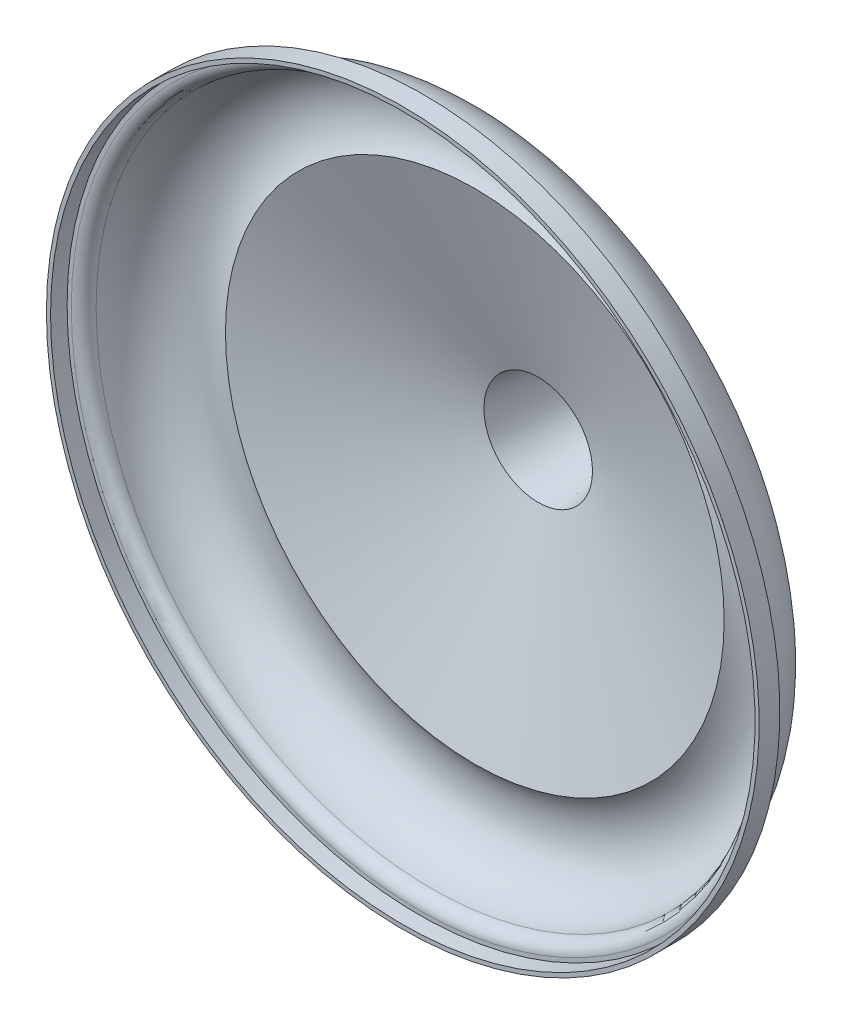
from build123d import *

# Parameters (mm, degrees)
SHELL1_T = -0.5


with BuildPart() as part:
    # Sketch1 → Revolve2 (revolve)
    with BuildSketch(Plane(origin=(0, 0, 0), x_dir=(1, 0, 0), z_dir=(0, 1, 0)), mode=Mode.PRIVATE) as revolve2_sk:
        with BuildLine():
            Line((0, 30), (0, 0))
            Line((0, 0), (43, 0))
            Line((43, 0), (43, 2.5))
            Line((43, 2.5), (42, 2.5))
            ThreePointArc((42, 2.5), (41.292893219, 2.792893219), (41, 3.5))
            ThreePointArc((41, 3.5), (37.240370349, 9.704836823), (30, 9.244562647))
            Line((30, 9.244562647), (7, 16.71771566))
            Line((7, 16.71771566), (5.15, 29.325565968))
            ThreePointArc((5.15, 29.325565968), (2.596986776, 29.830674716), (0, 30))
        make_face()
    revolve(revolve2_sk.sketch.rotate(Axis((0, 0, -30), (0, 0, 1)), 180), axis=Axis((0, 0, -30), (0, 0, 1)))

    # Shell1
    shell1_openings = [part.faces().sort_by_distance(p)[0] for p in [
        (0, 0, 0),
    ]]
    offset(amount=SHELL1_T, openings=shell1_openings, kind=Kind.INTERSECTION)


solid = part.part
